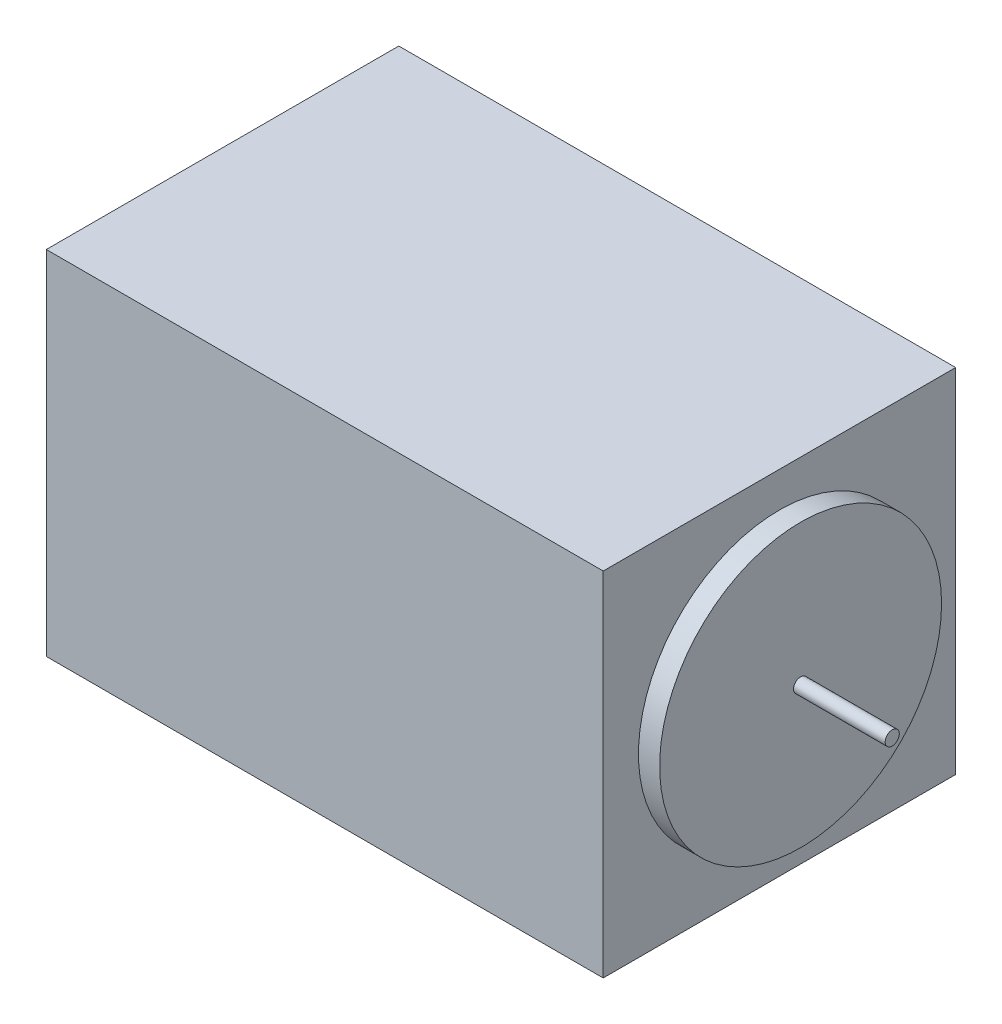
from build123d import *

# Parameters (mm, degrees)
SKETCH_1_W      = 50
SKETCH_1_H      = 50
EXTRUDE_1_DEPTH = 79
SKETCH_2_R      = 20
EXTRUDE_2_DEPTH = 82
SKETCH_3_R      = 1
EXTRUDE_3_DEPTH = 95


with BuildPart() as part:
    # 草图1 → 凸台-拉伸1 (new body)
    with BuildSketch(Plane(origin=(0, 0, 0), x_dir=(0, 0, -1), z_dir=(1, 0, 0))):
        Rectangle(SKETCH_1_W, SKETCH_1_H)
    extrude(amount=EXTRUDE_1_DEPTH)

    # 草图2 → 凸台-拉伸2 (add)
    with BuildSketch(Plane(origin=(0, 0, 0), x_dir=(0, 0, -1), z_dir=(1, 0, 0))):
        Circle(SKETCH_2_R)
    extrude(amount=EXTRUDE_2_DEPTH)

    # 草图3 → 凸台-拉伸3 (add)
    with BuildSketch(Plane(origin=(0, 0, 0), x_dir=(0, 0, -1), z_dir=(1, 0, 0))):
        Circle(SKETCH_3_R)
    extrude(amount=EXTRUDE_3_DEPTH)


solid = part.part
